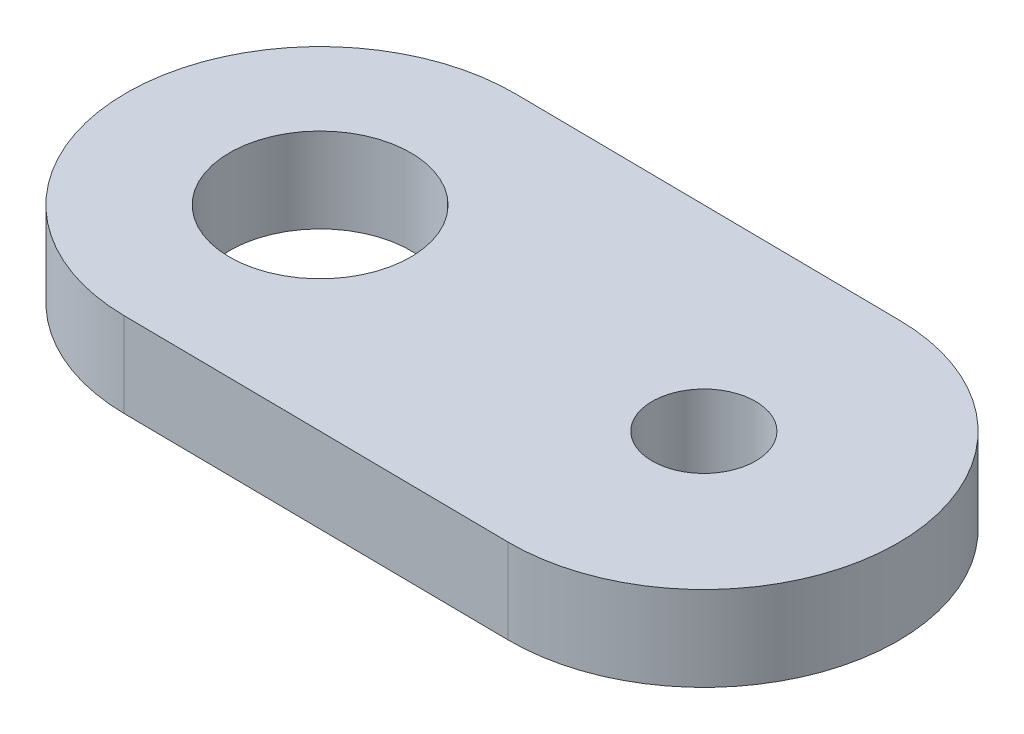
from build123d import *

# Parameters (mm, degrees)
SKETCH1_R           = 3.5
SKETCH1_R_2         = 2
BOSS_EXTRUDE1_DEPTH = 3.278212


with BuildPart() as part:
    # Sketch1 → Boss-Extrude1 (new body)
    with BuildSketch(Plane(origin=(0, -82.5, 0), x_dir=(1, 0, 0), z_dir=(0, 1, 0))):
        with BuildLine():
            Line((-104.920369031, -52.500422751), (-89.920369031, -52.659693668))
            ThreePointArc((-89.920369031, -52.659693668), (-82.500422751, -60.238901886), (-90.079630969, -67.658848165))
            Line((-90.079630969, -67.658848165), (-105.079630969, -67.499577249))
            ThreePointArc((-105.079630969, -67.499577249), (-112.499577249, -59.920369031), (-104.920369031, -52.500422751))
        make_face()
        with Locations(Location((-105, -60, 0), (0, 0, 270))):
            Circle(SKETCH1_R, mode=Mode.SUBTRACT)
        with Locations(Location((-90, -60.159270916, 0), (0, 0, 270))):
            Circle(SKETCH1_R_2, mode=Mode.SUBTRACT)
    extrude(amount=BOSS_EXTRUDE1_DEPTH)


solid = part.part
